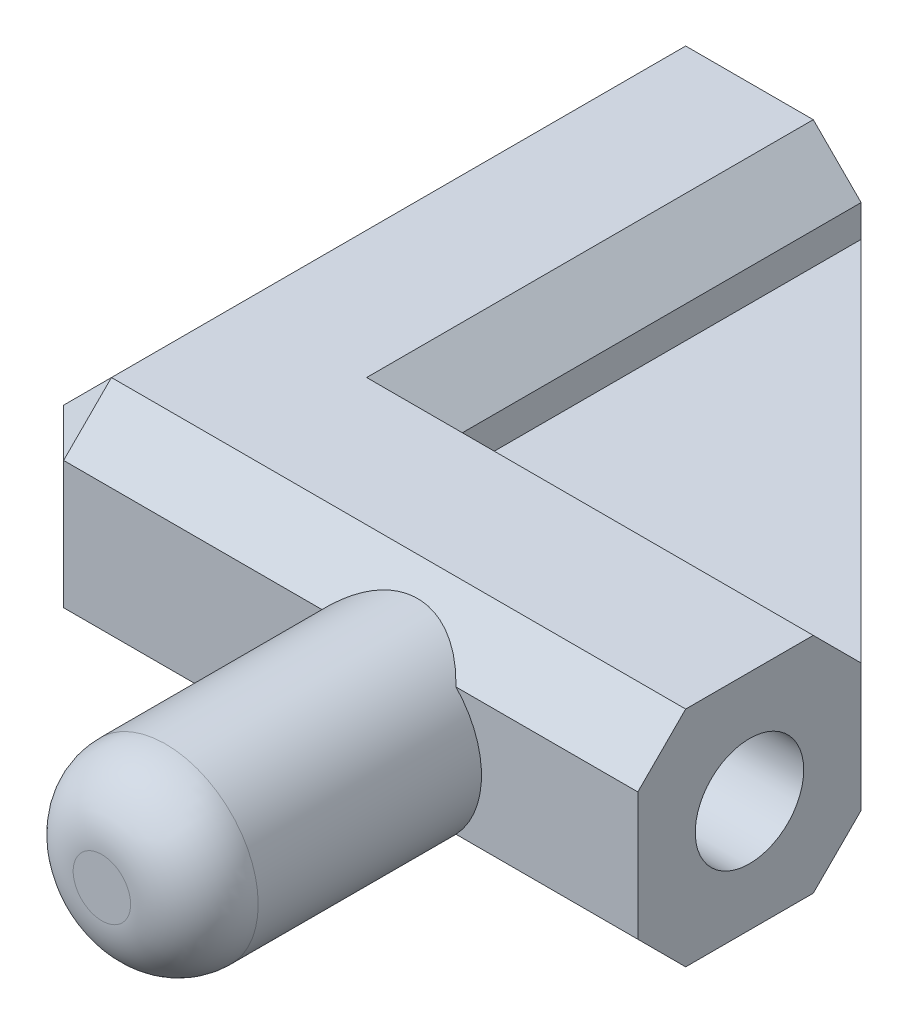
from build123d import *

# Parameters (mm, degrees)
BOSS_EXTRUDE1_DEPTH  = 3.5
SKETCH2_R            = 1.7
CUT_EXTRUDE1_DEPTH   = 14
SKETCH3_R            = 1.7
CUT_EXTRUDE2_DEPTH   = 14
BOSS_EXTRUDE2_DEPTH  = 1
CHAMFER1_SIZE        = 1.5
BOSS_EXTRUDE15_START = -0.9
SKETCH20_R           = 2.9
BOSS_EXTRUDE15_DEPTH = 9.9
FILLET1_R            = 2


with BuildPart() as part:
    # Sketch1 → Boss-Extrude1 (new, symmetric)
    with BuildSketch(Plane(origin=(0, 0, 0), x_dir=(1, 0, 0), z_dir=(0, 1, 0))):
        Polygon((-3.5, 16), (-3.5, -3.5), (16, -3.5), (16, 3.5), (3.5, 3.5), (3.5, 16), align=None)
    extrude(amount=BOSS_EXTRUDE1_DEPTH, both=True)

    # Sketch2 → Cut-Extrude1 (cut)
    with BuildSketch(Plane(origin=(0, 0, -16), x_dir=(-1, 0, 0), z_dir=(0, 0, -1))):
        Circle(SKETCH2_R)
    extrude(amount=-CUT_EXTRUDE1_DEPTH, mode=Mode.SUBTRACT)

    # Sketch3 → Cut-Extrude2 (cut)
    with BuildSketch(Plane(origin=(16, 0, 0), x_dir=(0, 0, -1), z_dir=(1, 0, 0))):
        Circle(SKETCH3_R)
    extrude(amount=-CUT_EXTRUDE2_DEPTH, mode=Mode.SUBTRACT)

    # Sketch4 → Boss-Extrude2 (add, symmetric)
    with BuildSketch(Plane(origin=(0, 0, 0), x_dir=(1, 0, 0), z_dir=(0, 1, 0))):
        Polygon((3.5, 16), (16, 3.5), (3.5, 3.5), align=None)
    extrude(amount=BOSS_EXTRUDE2_DEPTH, both=True)

    # Chamfer1
    chamfer1_edges = [part.edges().sort_by_distance(p)[0] for p in [
        (-3.5, 0, 3.5),
        (6.25, 3.5, 3.5),
        (9.75, 3.5, -3.5),
        (3.5, 3.5, -9.75),
        (3.5, -3.5, -9.75),
        (9.75, -3.5, -3.5),
        (6.25, -3.5, 3.5),
        (-3.5, -3.5, -6.25),
        (-3.5, 3.5, -6.25),
    ]]
    chamfer(chamfer1_edges, length=CHAMFER1_SIZE)

    # Sketch20 → Boss-Extrude15 (add)
    with BuildSketch(Plane.XY.offset(3.5).offset(BOSS_EXTRUDE15_START)):
        with Locations(Location((8.2, 0, 0), (0, 0, 223.602818973))):
            Circle(SKETCH20_R)
    extrude(amount=BOSS_EXTRUDE15_DEPTH)

    # Fillet1
    fillet1_edges = [part.edges().sort_by_distance(p)[0] for p in [
        (10.3, 2, 12.5),
    ]]
    fillet(fillet1_edges, radius=FILLET1_R)


solid = part.part
